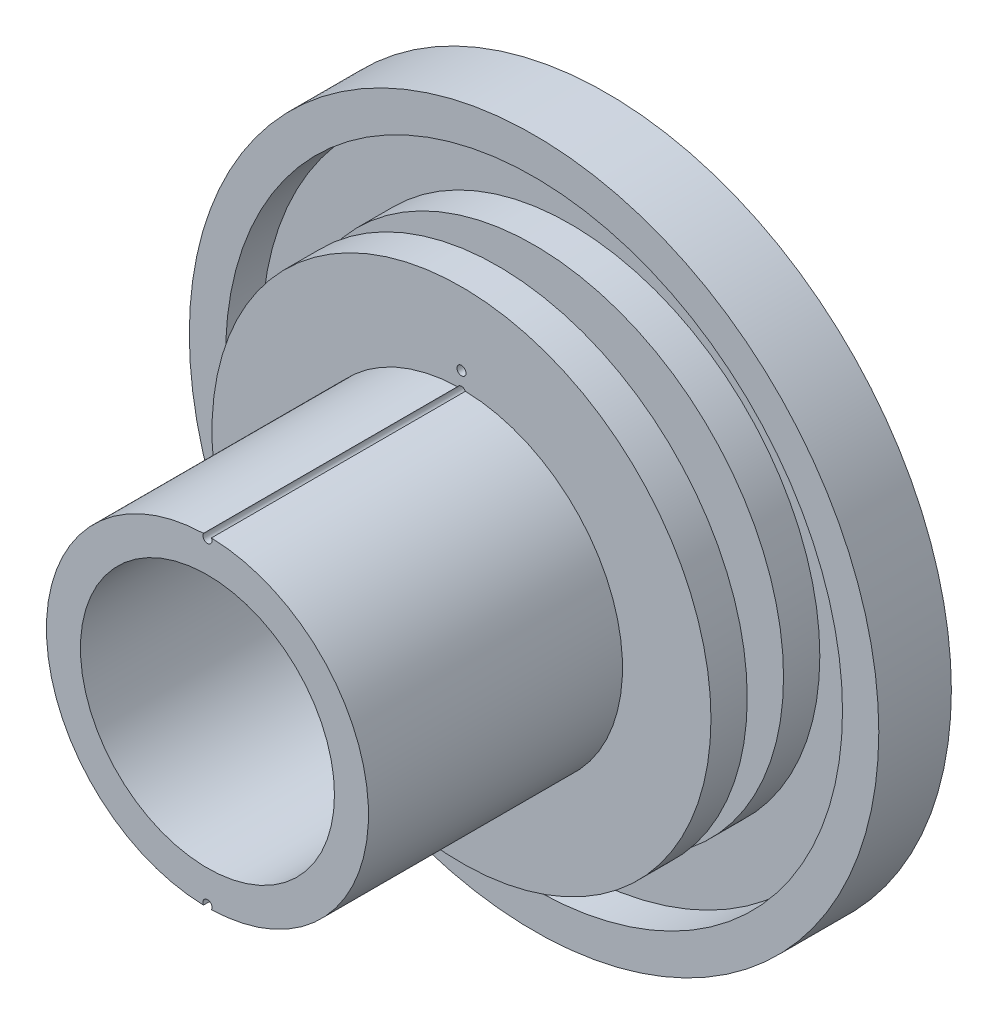
from build123d import *

# Parameters (mm, degrees)
SKETCH1_R           = 13.75
BOSS_EXTRUDE1_DEPTH = 2
SKETCH2_R           = 8.5
BOSS_EXTRUDE2_DEPTH = 6
BOSS_EXTRUDE3_START = 4
SKETCH3_R           = 13.75
BOSS_EXTRUDE3_DEPTH = 2
SKETCH5_R           = 7
CUT_EXTRUDE2_DEPTH  = 37.5
BOSS_EXTRUDE4_START = 20
SKETCH6_R           = 8.875
SKETCH6_R_2         = 7
BOSS_EXTRUDE4_DEPTH = 14
CUT_EXTRUDE3_START  = 4
SKETCH9_R           = 0.25
CUT_EXTRUDE3_DEPTH  = 24.894892006
SKETCH10_R          = 19
BOSS_EXTRUDE5_DEPTH = 2
SKETCH11_R          = 7
CUT_EXTRUDE4_DEPTH  = 2
BOSS_EXTRUDE6_START = 2
SKETCH12_R          = 19
SKETCH12_R_2        = 17
BOSS_EXTRUDE6_DEPTH = 2


with BuildPart() as part:
    # Sketch1 → Boss-Extrude1 (new body)
    with BuildSketch(Plane.XY):
        Circle(SKETCH1_R)
    extrude(amount=BOSS_EXTRUDE1_DEPTH)

    # Sketch2 → Boss-Extrude2 (add)
    with BuildSketch(Plane.XY):
        Circle(SKETCH2_R)
    extrude(amount=BOSS_EXTRUDE2_DEPTH)

    # Sketch3 → Boss-Extrude3 (add)
    with BuildSketch(Plane.XY.offset(BOSS_EXTRUDE3_START)):
        Circle(SKETCH3_R)
    extrude(amount=BOSS_EXTRUDE3_DEPTH)

    # Sketch5 → Cut-Extrude2 (cut, symmetric)
    with BuildSketch(Plane.XY):
        Circle(SKETCH5_R)
    extrude(amount=CUT_EXTRUDE2_DEPTH, both=True, mode=Mode.SUBTRACT)

    # Sketch6 → Boss-Extrude4 (add)
    with BuildSketch(Plane.XY.offset(BOSS_EXTRUDE4_START)):
        Circle(SKETCH6_R)
        Circle(SKETCH6_R_2, mode=Mode.SUBTRACT)
    extrude(amount=-BOSS_EXTRUDE4_DEPTH)

    # Sketch9 → Cut-Extrude3 (cut, through all)
    with BuildSketch(Plane.XY.offset(CUT_EXTRUDE3_START)):
        with Locations((0, 9.75)):
            Circle(SKETCH9_R)
        with Locations((0, -9.75)):
            Circle(SKETCH9_R)
        with Locations(Location((0, 8.75, 0), (0, 0, 150.706355545))):
            Circle(SKETCH9_R)
        with Locations(Location((0, -8.75, 0), (0, 0, 209.293644455))):
            Circle(SKETCH9_R)
    extrude(amount=CUT_EXTRUDE3_DEPTH, mode=Mode.SUBTRACT)

    # Sketch10 → Boss-Extrude5 (add)
    with BuildSketch(Plane.XY):
        Circle(SKETCH10_R)
    extrude(amount=-BOSS_EXTRUDE5_DEPTH)

    # Sketch11 → Cut-Extrude4 (cut)
    with BuildSketch(Plane.XY):
        Circle(SKETCH11_R)
    extrude(amount=-CUT_EXTRUDE4_DEPTH, mode=Mode.SUBTRACT)

    # Sketch12 → Boss-Extrude6 (add)
    with BuildSketch(Plane.XY.offset(BOSS_EXTRUDE6_START)):
        Circle(SKETCH12_R)
        Circle(SKETCH12_R_2, mode=Mode.SUBTRACT)
    extrude(amount=-BOSS_EXTRUDE6_DEPTH)


solid = part.part
